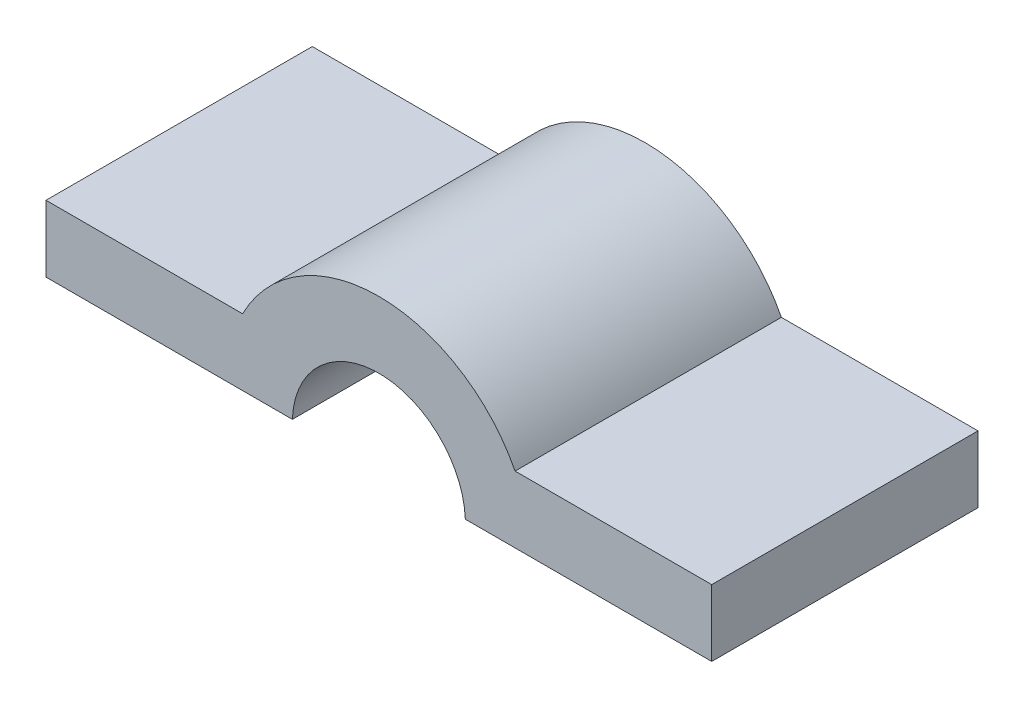
from build123d import *

# Parameters (mm, degrees)
BOSS_EXTRUDE1_DEPTH = 20


with BuildPart() as part:
    # Sketch1 → Boss-Extrude1 (new body)
    with BuildSketch(Plane.XY):
        with BuildLine():
            Line((-25, 0.25), (-11.497282288, 0.25))
            Line((-11.497282288, 0.25), (-6.495190528, 0.25))
            ThreePointArc((-6.495190528, 0.25), (0, 6.5), (6.495190528, 0.25))
            Line((6.495190528, 0.25), (11.497282288, 0.25))
            Line((11.497282288, 0.25), (25, 0.25))
            Line((25, 0.25), (25, 5.25))
            Line((25, 5.25), (10.231690965, 5.25))
            ThreePointArc((10.231690965, 5.25), (0, 11.5), (-10.231690965, 5.25))
            Line((-10.231690965, 5.25), (-25, 5.25))
            Line((-25, 5.25), (-25, 0.25))
        make_face()
    extrude(amount=-BOSS_EXTRUDE1_DEPTH)


solid = part.part
